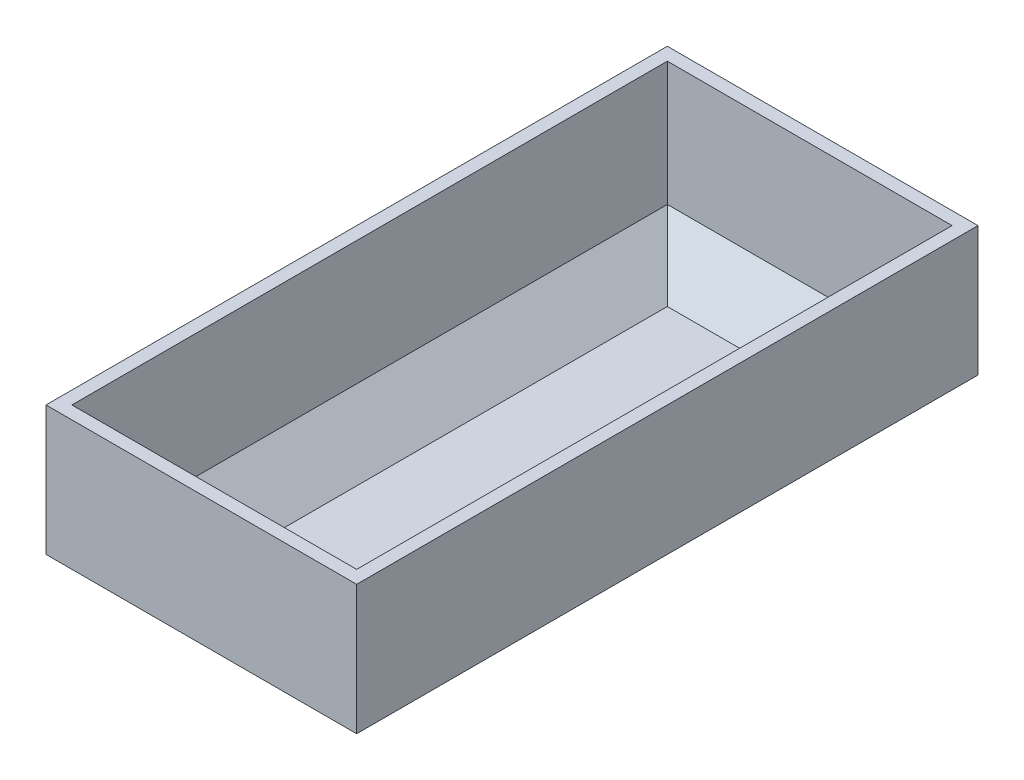
from build123d import *

# Parameters (mm, degrees)
BOSS_EXTRUDE1_DEPTH     = 304.8
CUT_EXTRUDE2_DEPTH      = 385.371747141
CUT_EXTRUDE2_DEPTH_BACK = 385.371747141
SHELL1_T                = -12.7


with BuildPart() as part:
    # Sketch1 → Boss-Extrude1 (new, symmetric)
    with BuildSketch(Plane.XY):
        Polygon((-101.6, 0), (101.6, 0), (152.4, 50.8), (152.4, 177.8), (-152.4, 177.8), (-152.4, 50.8), align=None)
    extrude(amount=BOSS_EXTRUDE1_DEPTH, both=True)

    # Sketch3 → Cut-Extrude2 (cut, two sides: drawn at the far end of the back side and taken through both)
    with BuildSketch(Plane(origin=(0, 0, 0), x_dir=(0, 0, -1), z_dir=(1, 0, 0)).offset(-CUT_EXTRUDE2_DEPTH_BACK)):
        Polygon((-304.8, 50.8), (-304.8, 0), (-254, 0), align=None)
        Polygon((304.8, 50.8), (304.8, 0), (254, 0), align=None)
    extrude(amount=CUT_EXTRUDE2_DEPTH + CUT_EXTRUDE2_DEPTH_BACK, mode=Mode.SUBTRACT)

    # Shell1
    shell1_openings = [part.faces().sort_by_distance(p)[0] for p in [
        (0, 177.8, 0),
    ]]
    offset(amount=SHELL1_T, openings=shell1_openings, kind=Kind.INTERSECTION)


solid = part.part
